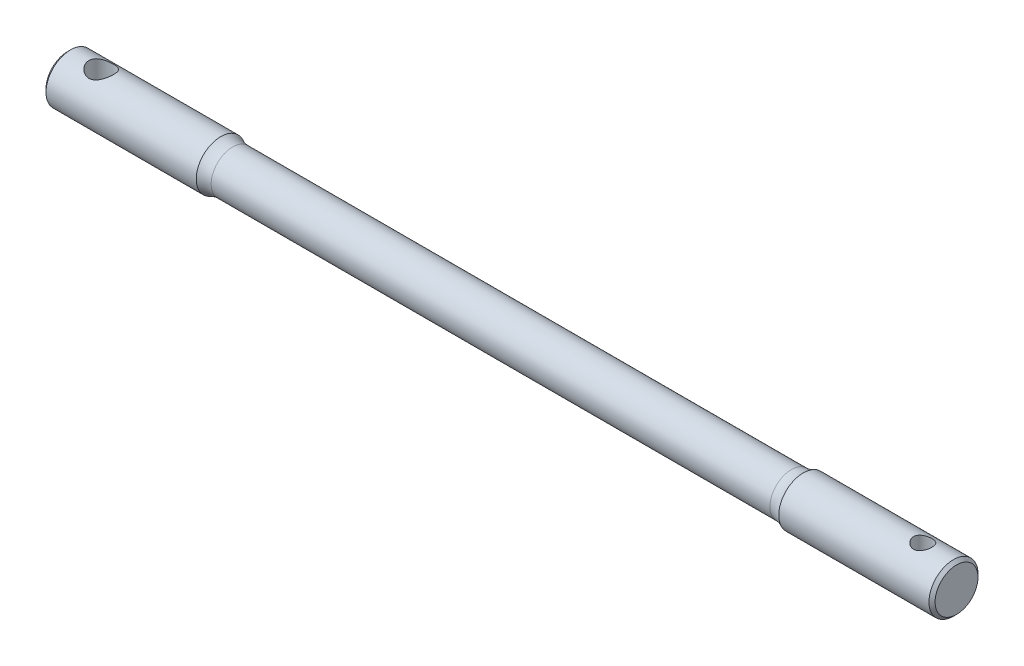
from build123d import *

# Parameters (mm, degrees)
ESQUISSE3_R             = 1.5
ESQUISSE3_R_2           = 2
ENL_V_MAT_EXTRU_2_DEPTH = 146.729200917
CHANFREIN1_SIZE         = 0.5


with BuildPart() as part:
    # Esquisse1 → Base-Révolution (revolve)
    with BuildSketch(Plane.XY, mode=Mode.PRIVATE) as base_r_volution_sk:
        with BuildLine():
            Line((0, 0), (0, 4))
            Line((0, 4), (-25, 4))
            ThreePointArc((-25, 4), (-25.936491673, 3.627016654), (-26.936491673, 3.5))
            Line((-26.936491673, 3.5), (-118.063508327, 3.5))
            ThreePointArc((-118.063508327, 3.5), (-119.063508327, 3.627016654), (-120, 4))
            Line((-120, 4), (-145, 4))
            Line((-145, 4), (-145, 0))
            Line((-145, 0), (0, 0))
        make_face()
    revolve(base_r_volution_sk.sketch.rotate(Axis((36, 0, 0), (-1, 0, 0)), 90), axis=Axis((36, 0, 0), (-1, 0, 0)))

    # Esquisse3 → Enlèv. mat.-Extru.2 (cut, through all)
    with BuildSketch(Plane(origin=(0, 10, 0), x_dir=(-1, 0, 0), z_dir=(0, 1, 0))):
        with Locations(Location((5.5, 0, 0), (0, 0, 90))):
            Circle(ESQUISSE3_R)
        with Locations(Location((139.5, 0, 0), (0, 0, 90))):
            Circle(ESQUISSE3_R_2)
    extrude(amount=-ENL_V_MAT_EXTRU_2_DEPTH, mode=Mode.SUBTRACT)

    # Chanfrein1
    chanfrein1_edges = [part.edges().sort_by_distance(p)[0] for p in [
        (0, 0, 4),
        (-145, 0, 4),
    ]]
    chamfer(chanfrein1_edges, length=CHANFREIN1_SIZE)


solid = part.part
